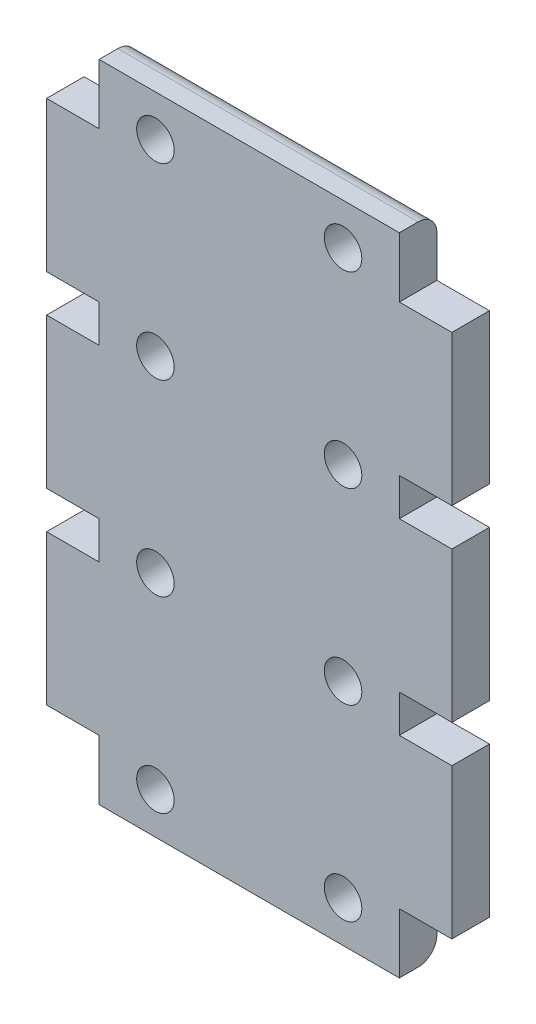
from build123d import *

# Parameters (mm, degrees)
SKETCH1_R           = 2.5
BOSS_EXTRUDE1_DEPTH = 5
FILLET1_R           = 2.5
FILLET2_R           = 2.5
SKETCH2_W           = 3
SKETCH2_H           = 70
CUT_EXTRUDE3_DEPTH  = 10


with BuildPart() as part:
    # Sketch1 → Boss-Extrude1 (new body)
    with BuildSketch(Plane.XY):
        Polygon((-50, 20), (-60, 20), (-60, 0), (-50, 0), (-50, -5), (-60, -5), (-60, -25), (-50, -25), (-50, -30), (-60, -30), (-60, -50), (-50, -50), (-50, -58), (-10, -58), (-10, -50), (0, -50), (0, -30), (-10, -30), (-10, -25), (0, -25), (0, -5), (-10, -5), (-10, 0), (0, 0), (0, 20), (-10, 20), (-10, 28), (-50, 28), align=None)
        with Locations((-42.5, 22.5)):
            Circle(SKETCH1_R, mode=Mode.SUBTRACT)
        with Locations((-17.5, 22.5)):
            Circle(SKETCH1_R, mode=Mode.SUBTRACT)
        with Locations((-42.5, -2.5)):
            Circle(SKETCH1_R, mode=Mode.SUBTRACT)
        with Locations((-17.5, -2.5)):
            Circle(SKETCH1_R, mode=Mode.SUBTRACT)
        with Locations((-17.5, -27.5)):
            Circle(SKETCH1_R, mode=Mode.SUBTRACT)
        with Locations((-42.5, -27.5)):
            Circle(SKETCH1_R, mode=Mode.SUBTRACT)
        with Locations((-17.5, -52.5)):
            Circle(SKETCH1_R, mode=Mode.SUBTRACT)
        with Locations((-42.5, -52.5)):
            Circle(SKETCH1_R, mode=Mode.SUBTRACT)
    extrude(amount=BOSS_EXTRUDE1_DEPTH)

    # Fillet1
    fillet1_edges = [part.edges().sort_by_distance(p)[0] for p in [
        (-30, -58, 0),
    ]]
    fillet(fillet1_edges, radius=FILLET1_R)

    # Fillet2
    fillet2_edges = [part.edges().sort_by_distance(p)[0] for p in [
        (-30, 28, 0),
    ]]
    fillet(fillet2_edges, radius=FILLET2_R)

    # Sketch2 → Cut-Extrude3 (cut)
    with BuildSketch(Plane(origin=(0, 0, 0), x_dir=(-1, 0, 0), z_dir=(0, 0, -1))):
        with Locations((58.5, -15)):
            Rectangle(SKETCH2_W, SKETCH2_H)
        with Locations((1.5, -15)):
            Rectangle(SKETCH2_W, SKETCH2_H)
    extrude(amount=-CUT_EXTRUDE3_DEPTH, mode=Mode.SUBTRACT)


solid = part.part
